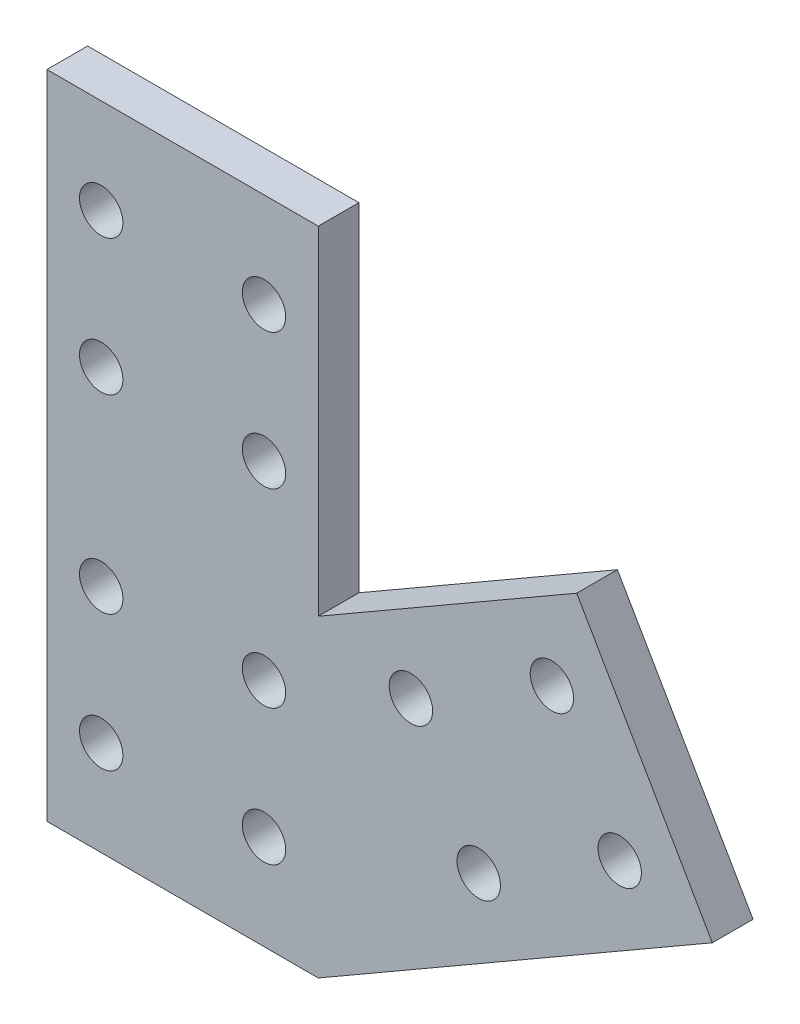
from build123d import *

# Parameters (mm, degrees)
EXTRUDE_1_DEPTH     = 3
SKETCH_2_R          = 1.6
CUT_EXTRUDE_1_DEPTH = 3


with BuildPart() as part:
    # 草图1 → 凸台-拉伸1 (new body)
    with BuildSketch(Plane.XY):
        Polygon((0, 48), (0, 0), (20, 0), (49.052558883, 16.773502692), (39.052558883, 34.094010768), (20, 23.094010768), (20, 48), align=None)
    extrude(amount=EXTRUDE_1_DEPTH)

    # 草图2 → 切除-拉伸1 (cut)
    with BuildSketch(Plane(origin=(0, 0, 0), x_dir=(-1, 0, 0), z_dir=(0, 0, -1))):
        with Locations((-42.222431864, 18.603629711)):
            Circle(SKETCH_2_R)
        with Locations((-37.222431864, 27.263883749)):
            Circle(SKETCH_2_R)
        with Locations((-26.830127019, 21.263883749)):
            Circle(SKETCH_2_R)
        with Locations((-31.830127019, 12.603629711)):
            Circle(SKETCH_2_R)
        with Locations((-16, 7)):
            Circle(SKETCH_2_R)
        with Locations((-16, 17)):
            Circle(SKETCH_2_R)
        with Locations((-4, 7)):
            Circle(SKETCH_2_R)
        with Locations((-4, 17)):
            Circle(SKETCH_2_R)
        with Locations((-16, 31)):
            Circle(SKETCH_2_R)
        with Locations((-16, 41)):
            Circle(SKETCH_2_R)
        with Locations((-4, 31)):
            Circle(SKETCH_2_R)
        with Locations((-4, 41)):
            Circle(SKETCH_2_R)
    extrude(amount=-CUT_EXTRUDE_1_DEPTH, mode=Mode.SUBTRACT)


solid = part.part
